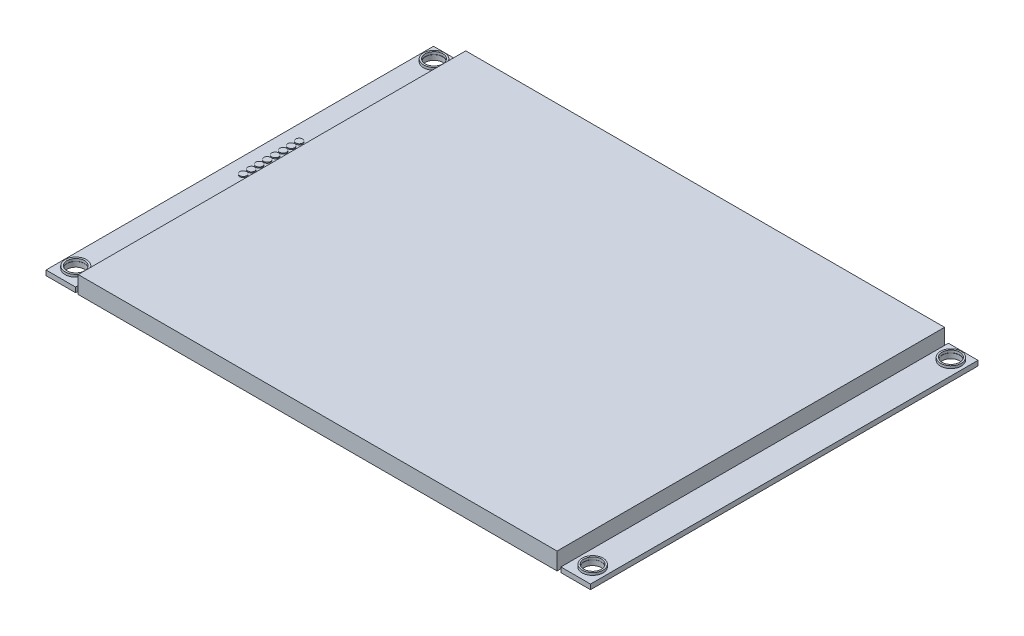
from build123d import *

# Parameters (mm, degrees)
SKETCH8_W             = 6
SKETCH8_H             = 78.5
BOSS_EXTRUDE8_DEPTH   = 1
BOSS_EXTRUDE8_2_DEPTH = 1
SKETCH9_W             = 97
SKETCH9_H             = 78.5
BOSS_EXTRUDE9_DEPTH   = 3.5
SKETCH11_R            = 1.75
CUT_EXTRUDE1_DEPTH    = 112.059131114
SKETCH12_R            = 0.7
BOSS_EXTRUDE10_DEPTH  = 0.2
SKETCH13_R            = 2.123968159
SKETCH13_R_2          = 2.154896851
SKETCH13_R_3          = 2.11
BOSS_EXTRUDE11_DEPTH  = 0.5
SKETCH14_R            = 1.785
CUT_EXTRUDE3_DEPTH    = 112.059131114


with BuildPart() as part:
    # Sketch8 → Boss-Extrude8 (new body)
    with BuildSketch(Plane(origin=(-0.323397681, 0, 0), x_dir=(1, 0, 0), z_dir=(0, 1, 0))):
        with Locations((-90.395805492, 20.233804336)):
            Rectangle(SKETCH8_W, SKETCH8_H)
    extrude(amount=BOSS_EXTRUDE8_DEPTH)


with BuildPart() as body_2:
    # Sketch8 → Boss-Extrude8 2 (new body)
    with BuildSketch(Plane(origin=(-0.323397681, 0, 0), x_dir=(1, 0, 0), z_dir=(0, 1, 0))):
        with Locations((13.851518893, 20.286472522)):
            Rectangle(SKETCH8_W, SKETCH8_H)
    extrude(amount=BOSS_EXTRUDE8_2_DEPTH)


with BuildPart() as body_3:
    # Sketch9 → Boss-Extrude9 (new body)
    with BuildSketch(Plane(origin=(0, 0, 0), x_dir=(1, 0, 0), z_dir=(0, 1, 0))):
        with Locations((-38.652522409, 20.192494726)):
            Rectangle(SKETCH9_W, SKETCH9_H)
    extrude(amount=BOSS_EXTRUDE9_DEPTH)


with BuildPart() as cut_extrude1_tool:
    # Sketch11 → Cut-Extrude1 (new, through all)
    with BuildSketch(Plane(origin=(0, 1, 0), x_dir=(1, 0, 0), z_dir=(0, 1, 0))):
        with Locations(Location((-90.956593125, 56.823654184, 0), (0, 0, 270))):
            Circle(SKETCH11_R)
        with Locations(Location((-90.956593125, -15.748050119, 0), (0, 0, 270))):
            Circle(SKETCH11_R)
        with Locations(Location((13.744296074, 56.823654184, 0), (0, 0, 270))):
            Circle(SKETCH11_R)
        with Locations(Location((13.744296074, -15.748050119, 0), (0, 0, 270))):
            Circle(SKETCH11_R)
    extrude(amount=-CUT_EXTRUDE1_DEPTH)


with BuildPart() as part_1:
    add(part.part)

    # Cut-Extrude1: cut by cut_extrude1_tool
    add(cut_extrude1_tool.part, mode=Mode.SUBTRACT)

    # Sketch12 → Boss-Extrude10 (add)
    with BuildSketch(Plane(origin=(0, 1, 0), x_dir=(1, 0, 0), z_dir=(0, 1, 0))):
        with Locations(Location((-90.503667858, 27.428777133, 0), (0, 0, 270))):
            Circle(SKETCH12_R)
        with Locations(Location((-90.503667858, 25.80867974, 0), (0, 0, 270))):
            Circle(SKETCH12_R)
        with Locations(Location((-90.503667858, 24.188582347, 0), (0, 0, 270))):
            Circle(SKETCH12_R)
        with Locations(Location((-90.503667858, 22.604964276, 0), (0, 0, 270))):
            Circle(SKETCH12_R)
        with Locations(Location((-90.503667858, 20.950555843, 0), (0, 0, 270))):
            Circle(SKETCH12_R)
        with Locations(Location((-90.43834135, 19.295186446, 0), (0, 0, 270))):
            Circle(SKETCH12_R)
        with Locations(Location((-90.43834135, 17.659769941, 0), (0, 0, 270))):
            Circle(SKETCH12_R)
        with Locations(Location((-90.503667858, 29.06283674, 0), (0, 0, 270))):
            Circle(SKETCH12_R)
    extrude(amount=BOSS_EXTRUDE10_DEPTH)



with BuildPart() as body_2_1:
    add(body_2.part)

    # Cut-Extrude1: cut by cut_extrude1_tool
    add(cut_extrude1_tool.part, mode=Mode.SUBTRACT)


with BuildPart() as part_2:
    add(part_1.part)

    add(body_2_1.part)  # Boss-Extrude11 merges body 2
    # Sketch13 → Boss-Extrude11 (add)
    with BuildSketch(Plane(origin=(0, 1, 0), x_dir=(1, 0, 0), z_dir=(0, 1, 0))):
        with Locations(Location((-90.956593125, 56.823654184, 0), (0, 0, 90))):
            Circle(SKETCH13_R)
        with Locations(Location((-90.956593125, -15.748050119, 0), (0, 0, 90))):
            Circle(SKETCH13_R_2)
        with Locations(Location((13.744296074, 56.823654184, 0), (0, 0, 270))):
            Circle(SKETCH13_R_3)
        with Locations(Location((13.744296074, -15.748050119, 0), (0, 0, 90))):
            Circle(SKETCH13_R_3)
    extrude(amount=BOSS_EXTRUDE11_DEPTH)

    # Sketch14 → Cut-Extrude3 (cut, through all)
    with BuildSketch(Plane(origin=(0, 1, 0), x_dir=(1, 0, 0), z_dir=(0, 1, 0))):
        with Locations(Location((-90.96274165, 56.8350124, 0), (0, 0, 270))):
            Circle(SKETCH14_R)
        with Locations(Location((-90.956593125, -15.748050119, 0), (0, 0, 270))):
            Circle(SKETCH14_R)
        with Locations(Location((13.744296074, -15.748050119, 0), (0, 0, 270))):
            Circle(SKETCH14_R)
        with Locations(Location((13.744296074, 56.8350124, 0), (0, 0, 270))):
            Circle(SKETCH14_R)
    extrude(amount=CUT_EXTRUDE3_DEPTH, mode=Mode.SUBTRACT)


solid = Compound([body_3.part, part_2.part])
